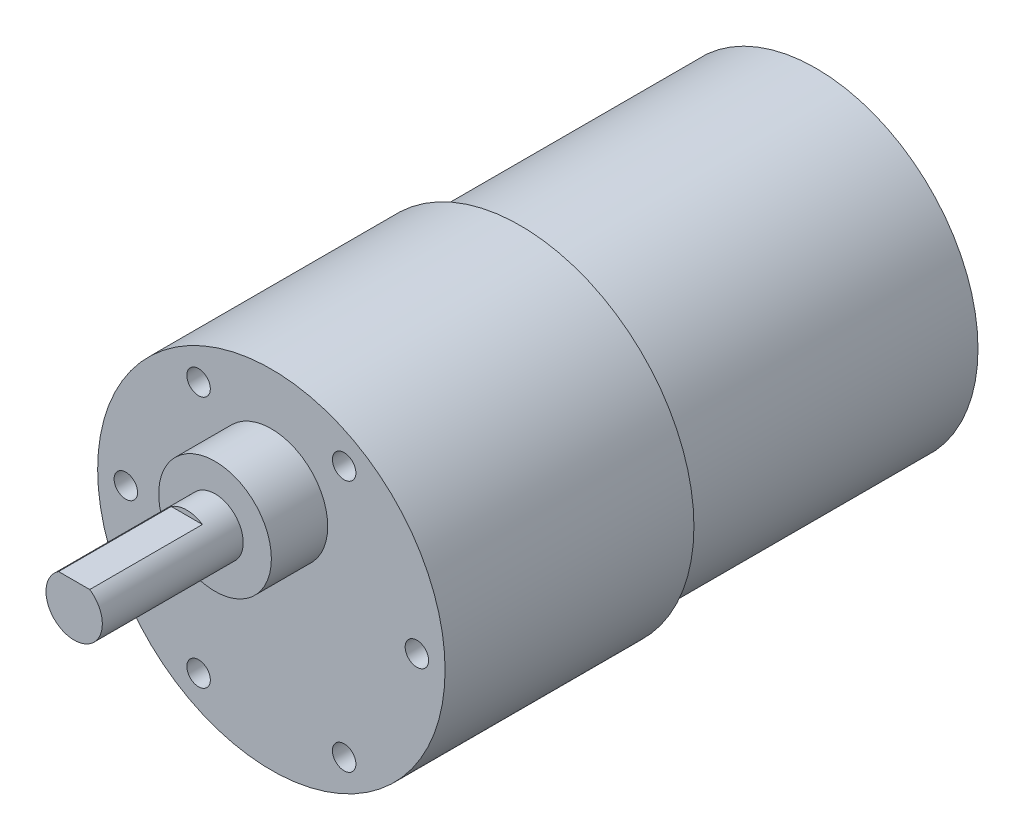
from build123d import *

# Parameters (mm, degrees)
SKETCH1_R           = 18.5
BOSS_EXTRUDE1_DEPTH = 29
CUT_EXTRUDE1_START  = -31.5
SKETCH2_R           = 18.5
SKETCH2_R_2         = 17.25
CUT_EXTRUDE1_DEPTH  = 31.5
SKETCH3_R           = 6
BOSS_EXTRUDE2_DEPTH = 6
SKETCH4_R           = 3
BOSS_EXTRUDE3_DEPTH = 15
CUT_EXTRUDE2_START  = -12
CUT_EXTRUDE2_DEPTH  = 12
CIRPATTERN1_COUNT   = 6


with BuildPart() as part:
    # Sketch1 → Boss-Extrude1 (new, symmetric)
    with BuildSketch(Plane.XY):
        with Locations(Location((0, 0, 0), (0, 0, 180))):
            Circle(SKETCH1_R)
    extrude(amount=BOSS_EXTRUDE1_DEPTH, both=True)

    # Sketch2 → Cut-Extrude1 (cut)
    with BuildSketch(Plane(origin=(0, 0, -29), x_dir=(-1, 0, 0), z_dir=(0, 0, -1)).offset(CUT_EXTRUDE1_START)):
        Circle(SKETCH2_R)
        Circle(SKETCH2_R_2, mode=Mode.SUBTRACT)
    extrude(amount=CUT_EXTRUDE1_DEPTH, mode=Mode.SUBTRACT)

    # Sketch3 → Boss-Extrude2 (add)
    with BuildSketch(Plane.XY.offset(29)):
        with Locations((0, 7)):
            Circle(SKETCH3_R)
    extrude(amount=BOSS_EXTRUDE2_DEPTH)

    # Sketch4 → Boss-Extrude3 (add)
    with BuildSketch(Plane.XY.offset(35)):
        with Locations((0, 7)):
            Circle(SKETCH4_R)
    extrude(amount=BOSS_EXTRUDE3_DEPTH)

    # Sketch5 → Cut-Extrude2 (cut)
    with BuildSketch(Plane.XY.offset(50).offset(CUT_EXTRUDE2_START)):
        with BuildLine():
            Line((-1.658312395, 9.5), (1.658312395, 9.5))
            ThreePointArc((1.658312395, 9.5), (0, 10), (-1.658312395, 9.5))
        make_face()
    extrude(amount=CUT_EXTRUDE2_DEPTH, mode=Mode.SUBTRACT)

    # Sketch7 → M3x0.5 Tapped Hole1 (revolve, cut)
    with BuildSketch(Plane(origin=(7.75, 13.423393759, 29), x_dir=(0, -1, 0), z_dir=(1, 0, 0))):
        Polygon((0, 0), (0, 4.251075774), (1.25, 3.5), (1.25, 0), align=None)
    m3x0_5_tapped_hole1 = revolve(axis=Axis((7.75, 13.423393759, 35.35), (0, 0, -1)), mode=Mode.SUBTRACT)

    # CirPattern1: M3x0.5 Tapped Hole1 ×6 about axis
    cirpattern1_axis = Axis((0, 0, 0), (0, 0, 1))
    for i in range(1, CIRPATTERN1_COUNT):
        add(m3x0_5_tapped_hole1.rotate(cirpattern1_axis, i * 360 / CIRPATTERN1_COUNT), mode=Mode.SUBTRACT)


solid = part.part
